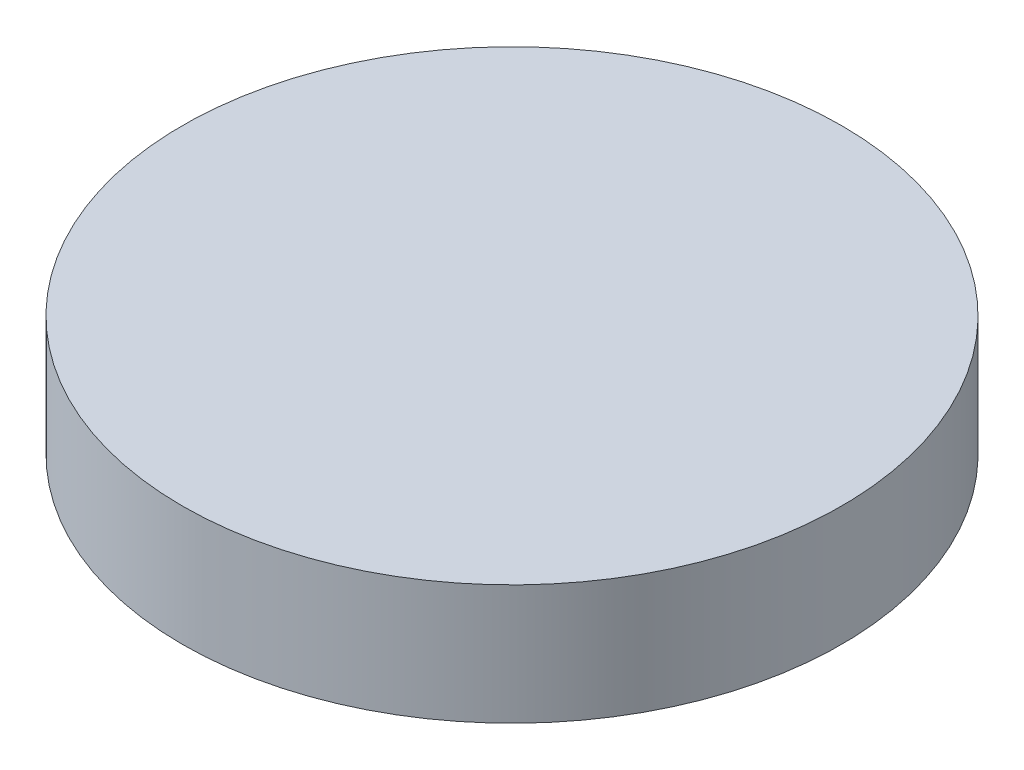
from build123d import *

# Parameters (mm, degrees)
SKETCH1_R           = 34.925
BOSS_EXTRUDE1_DEPTH = 12.7
SKETCH1_3_R         = 16.764
CUT_EXTRUDE1_DEPTH  = 6.096


with BuildPart() as part:
    # Sketch1 → Boss-Extrude1 (new body)
    with BuildSketch(Plane(origin=(0, 0, 0), x_dir=(1, 0, 0), z_dir=(0, 1, 0))):
        Circle(SKETCH1_R)
    extrude(amount=BOSS_EXTRUDE1_DEPTH)

    # Sketch1<3> → Cut-Extrude1 (cut)
    with BuildSketch(Plane(origin=(0, 0, 0), x_dir=(1, 0, 0), z_dir=(0, 1, 0))):
        Circle(SKETCH1_3_R)
    extrude(amount=CUT_EXTRUDE1_DEPTH, mode=Mode.SUBTRACT)


solid = part.part
